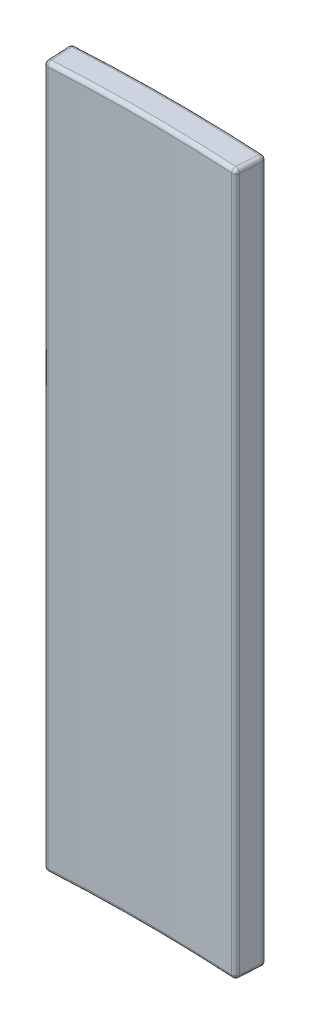
from build123d import *

# Parameters (mm, degrees)
P_IDAT_VYSUNUT_M1_DEPTH = 18
ZAOBLIT1_R              = 0.1


with BuildPart() as part:
    # Skica1 → Přidat vysunutím1 (new body)
    with BuildSketch(Plane(origin=(0, 0, 0), x_dir=(1, 0, 0), z_dir=(0, 1, 0))):
        with BuildLine():
            Line((-2.5, 42.426406871), (-2.455882353, 41.677705573))
            ThreePointArc((-2.455882353, 41.677705573), (0, 41.75), (2.455882353, 41.677705573))
            Line((2.455882353, 41.677705573), (2.5, 42.426406871))
            ThreePointArc((2.5, 42.426406871), (0, 42.5), (-2.5, 42.426406871))
        make_face()
    extrude(amount=P_IDAT_VYSUNUT_M1_DEPTH)

    # Zaoblit1
    zaoblit1_edges = [part.edges().sort_by_distance(p)[0] for p in [
        (0, 18, -41.75),
        (2.477941176, 18, -42.052056222),
        (0, 18, -42.5),
        (2.477941176, 0, -42.052056222),
        (0, 0, -41.75),
        (-2.477941176, 0, -42.052056222),
        (0, 0, -42.5),
        (2.5, 9, -42.426406871),
        (2.455882353, 9, -41.677705573),
        (-2.455882353, 9, -41.677705573),
        (-2.5, 9, -42.426406871),
        (-2.477941176, 18, -42.052056222),
    ]]
    fillet(zaoblit1_edges, radius=ZAOBLIT1_R)


solid = part.part
